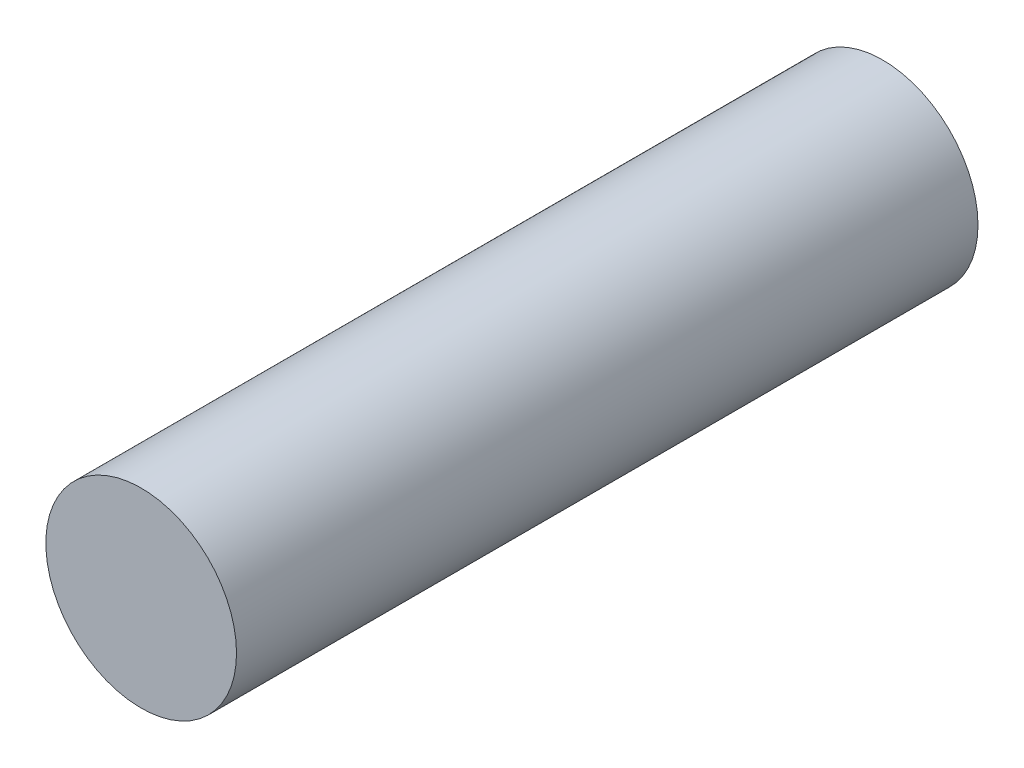
from build123d import *

# Parameters (mm, degrees)
SKETCH_1_R      = 9
EXTRUDE_1_DEPTH = 70


with BuildPart() as part:
    # Эскиз1 → Бобышка-Вытянуть1 (new body)
    with BuildSketch(Plane.XY):
        Circle(SKETCH_1_R)
    extrude(amount=EXTRUDE_1_DEPTH)


solid = part.part
